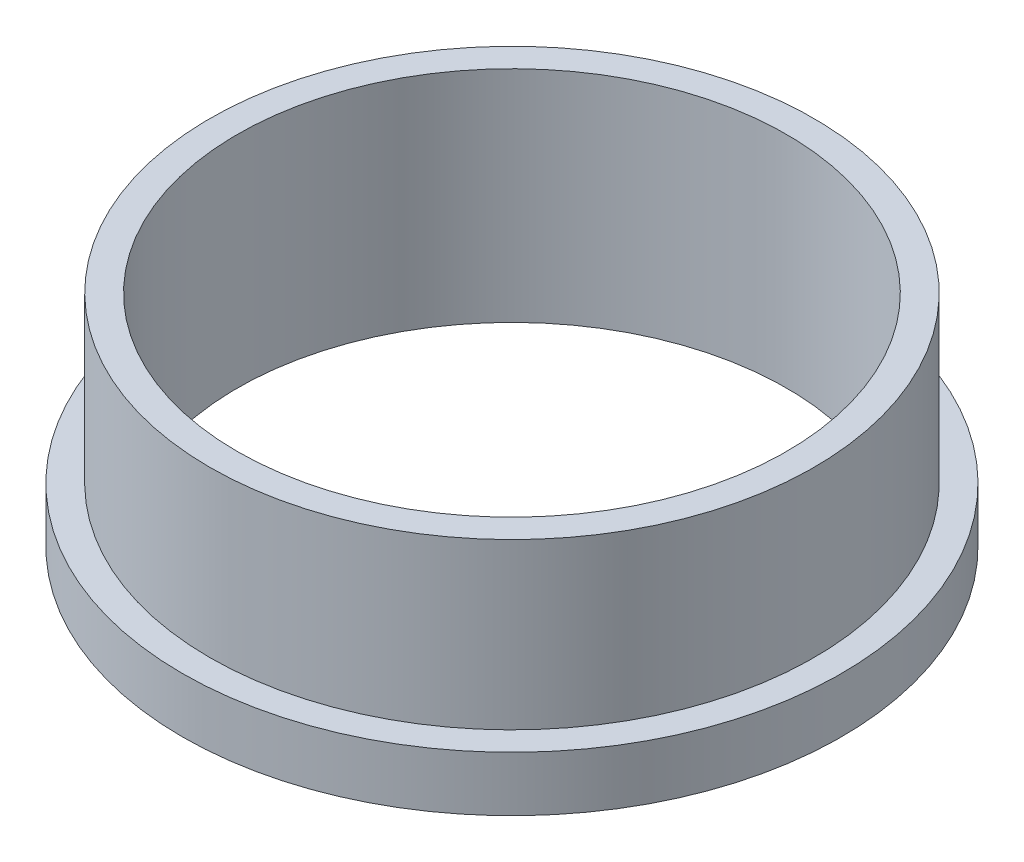
from build123d import *

# Parameters (mm, degrees)
SKETCH1_R           = 30
SKETCH1_R_2         = 25
BOSS_EXTRUDE1_DEPTH = 20
CUT_EXTRUDE2_START  = -15
SKETCH2_R           = 30
SKETCH2_R_2         = 27.5
CUT_EXTRUDE2_DEPTH  = 15


with BuildPart() as part:
    # Sketch1 → Boss-Extrude1 (new body)
    with BuildSketch(Plane(origin=(0, 0, 0), x_dir=(1, 0, 0), z_dir=(0, 1, 0))):
        with Locations(Location((0, 0, 0), (0, 0, 270))):
            Circle(SKETCH1_R)
        with Locations(Location((0, 0, 0), (0, 0, 270))):
            Circle(SKETCH1_R_2, mode=Mode.SUBTRACT)
    extrude(amount=BOSS_EXTRUDE1_DEPTH)

    # Sketch2 → Cut-Extrude2 (cut)
    with BuildSketch(Plane(origin=(0, 20, 0), x_dir=(1, 0, 0), z_dir=(0, 1, 0)).offset(CUT_EXTRUDE2_START)):
        with Locations(Location((0, 0, 0), (0, 0, 270))):
            Circle(SKETCH2_R)
        with Locations(Location((0, 0, 0), (0, 0, 270))):
            Circle(SKETCH2_R_2, mode=Mode.SUBTRACT)
    extrude(amount=CUT_EXTRUDE2_DEPTH, mode=Mode.SUBTRACT)


solid = part.part
